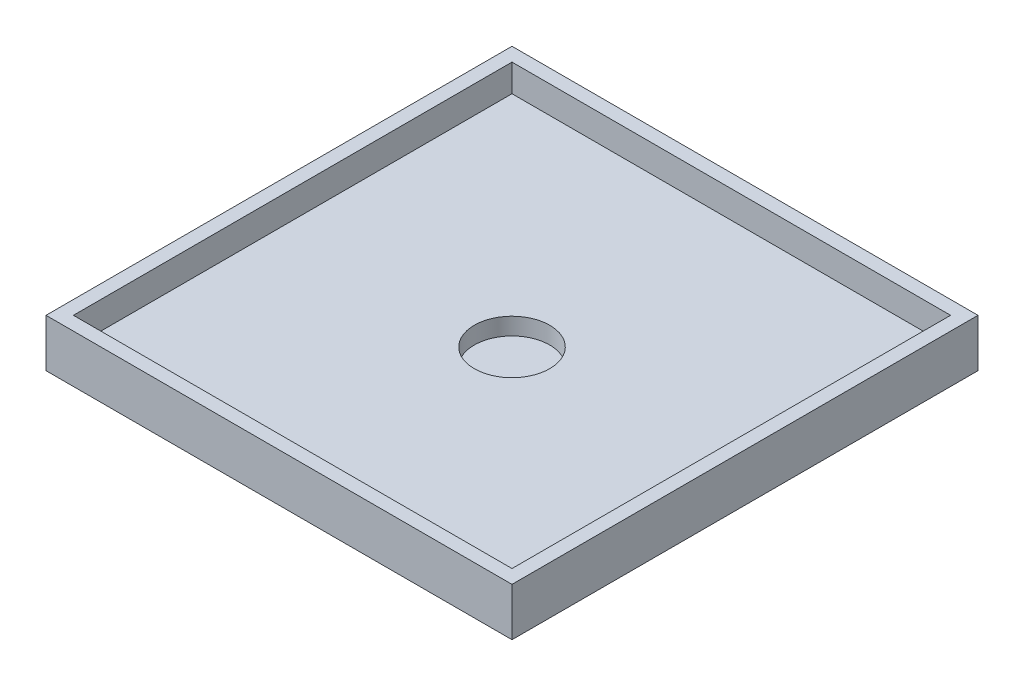
from build123d import *

# Parameters (mm, degrees)
SKETCH1_W           = 68
SKETCH1_H           = 68
BOSS_EXTRUDE1_DEPTH = 7
SKETCH2_W           = 64
SKETCH2_H           = 64
CUT_EXTRUDE1_DEPTH  = 4
SKETCH3_R           = 5.5
CUT_EXTRUDE2_DEPTH  = 2.5


with BuildPart() as part:
    # Sketch1 → Boss-Extrude1 (new body)
    with BuildSketch(Plane(origin=(0, 0, 0), x_dir=(1, 0, 0), z_dir=(0, 1, 0))):
        Rectangle(SKETCH1_W, SKETCH1_H)
    extrude(amount=BOSS_EXTRUDE1_DEPTH)

    # Sketch2 → Cut-Extrude1 (cut)
    with BuildSketch(Plane(origin=(0, 7, 0), x_dir=(1, 0, 0), z_dir=(0, 1, 0))):
        Rectangle(SKETCH2_W, SKETCH2_H)
    extrude(amount=-CUT_EXTRUDE1_DEPTH, mode=Mode.SUBTRACT)

    # Sketch3 → Cut-Extrude2 (cut)
    with BuildSketch(Plane(origin=(0, 3, 0), x_dir=(1, 0, 0), z_dir=(0, 1, 0))):
        with Locations(Location((0, 0, 0), (0, 0, 270))):
            Circle(SKETCH3_R)
    extrude(amount=-CUT_EXTRUDE2_DEPTH, mode=Mode.SUBTRACT)


solid = part.part
